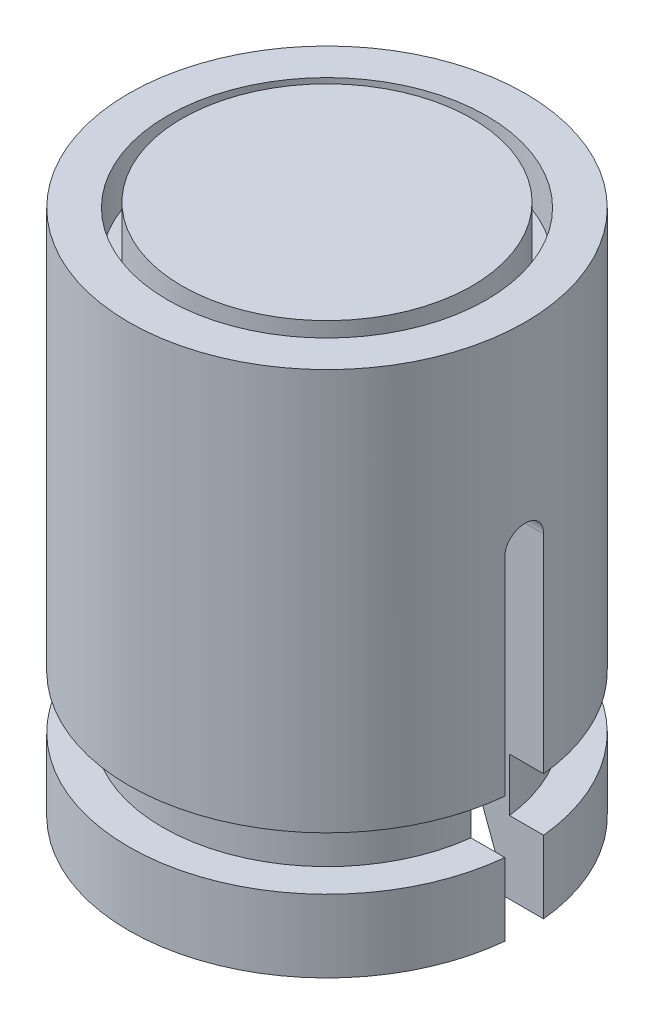
from build123d import *

# Parameters (mm, degrees)
WYTNIJ_WYCI_GNI_CIE1_DEPTH      = 13.434629066
WYTNIJ_WYCI_GNI_CIE1_DEPTH_BACK = 13.434629066


with BuildPart() as part:
    # Szkic2 → Obrót1 (revolve)
    with BuildSketch(Plane(origin=(0, 0, 0), x_dir=(0, 0, -1), z_dir=(1, 0, 0))):
        Polygon((-3.3, 10.9), (-3.3, 9.9), (-3, 9.9), (-3, 11), (0, 11), (0, 8.6), (-1.35, 8.6), (-1.35, 7.4), (-2.85, 7.4), (-2.85, 1.404592906), (-3.142847868, 0.6), (-3.142847868, 0), (-4.1, 0), (-4.1, 1.5), (-3.4, 1.5), (-3.4, 2.6), (-4.1, 2.6), (-4.1, 10.9), align=None)
    revolve(axis=Axis((0, 0, 0), (0, -1, 0)))

    # Szkic3 → Wytnij-wyciągnięcie1 (cut, two sides: drawn at the far end of the back side and taken through both)
    with BuildSketch(Plane(origin=(0, 0, 0), x_dir=(0, 0, -1), z_dir=(1, 0, 0)).offset(-WYTNIJ_WYCI_GNI_CIE1_DEPTH_BACK)):
        with BuildLine():
            Line((-0.4, 0), (-0.4, 6.9))
            ThreePointArc((-0.4, 6.9), (0, 7.3), (0.4, 6.9))
            Line((0.4, 6.9), (0.4, 0))
            Line((0.4, 0), (-0.4, 0))
        make_face()
    extrude(amount=WYTNIJ_WYCI_GNI_CIE1_DEPTH + WYTNIJ_WYCI_GNI_CIE1_DEPTH_BACK, mode=Mode.SUBTRACT)


solid = part.part
